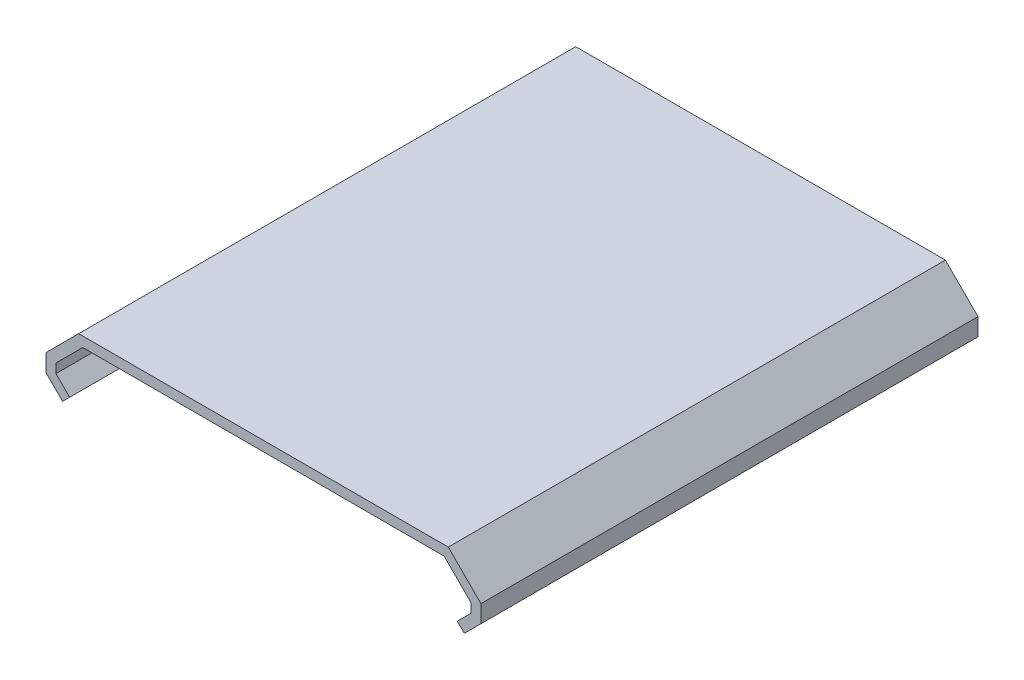
from build123d import *

# Parameters (mm, degrees)
EXTRUDE_1_DEPTH   = 200
EXTRUDE_1_2_DEPTH = 18


with BuildPart() as part:
    # 草图1 → Extrude 1 (new body)
    with BuildSketch(Plane.XY):
        Polygon((78, 32), (83.5, 37.5), (83.5, 41.207106781), (72.707106781, 52), (0, 52), (-72.707106781, 52), (-83.5, 41.207106781), (-83.5, 37.5), (-78, 32), (-80.828427125, 29.171572875), (-87.5, 35.843145751), (-87.5, 42.863961031), (-74.363961031, 56), (0, 56), (74.363961031, 56), (87.5, 42.863961031), (87.5, 35.843145751), (80.828427125, 29.171572875), align=None)
    extrude(amount=-EXTRUDE_1_DEPTH)

    # 草图2 → Extrude 1 2 (add)
    with BuildSketch(Plane(origin=(0, 0, -200), x_dir=(-1, 0, 0), z_dir=(0, 0, -1))):
        Polygon((-8.414213562, 52), (3, 52), (3, 40.585786438), align=None)
    extrude(amount=-EXTRUDE_1_2_DEPTH)


solid = part.part
